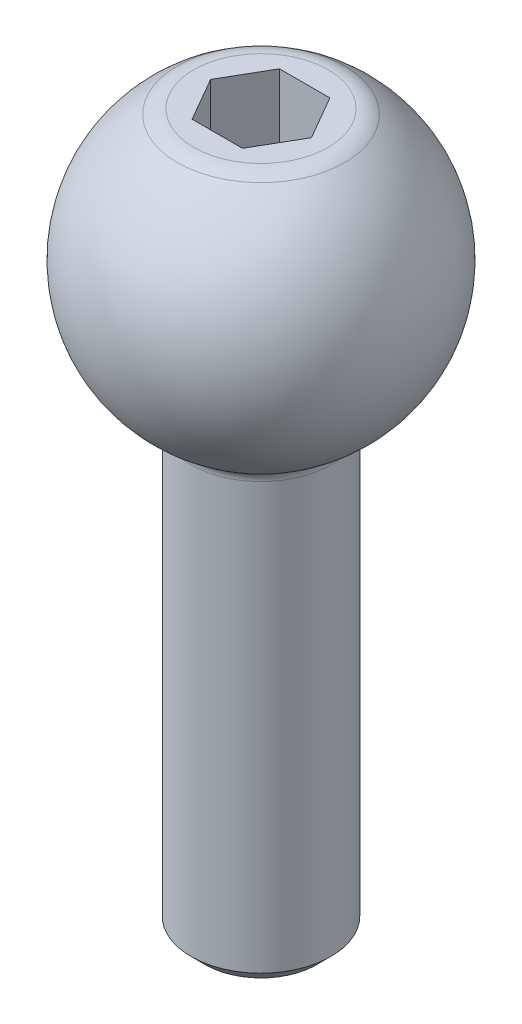
from build123d import *

# Parameters (mm, degrees)
FILLET1_R          = 0.381
CHAMFER1_SIZE      = 0.381
FILLET2_R          = 0.8128
CUT_EXTRUDE1_DEPTH = 2.54


with BuildPart() as part:
    # Sketch1 → Revolve1 (revolve)
    with BuildSketch(Plane.XY):
        with BuildLine():
            ThreePointArc((-1.905, -3.661588624), (-0.980573609, -4.009330573), (0, -4.1275))
            Line((0, -4.1275), (0, 4.1275))
            ThreePointArc((0, 4.1275), (-4.009330573, 0.980573609), (-1.905, -3.661588624))
        make_face()
        with BuildLine():
            Line((-1.905, -15.875), (0, -15.875))
            Line((0, -15.875), (0, -4.1275))
            ThreePointArc((0, -4.1275), (-0.980573609, -4.009330573), (-1.905, -3.661588624))
            Line((-1.905, -3.661588624), (-1.905, -15.875))
        make_face()
    revolve(axis=Axis((0, -107.836660193, 0), (0, 1, 0)))

    # Fillet1
    fillet1_edges = [part.edges().sort_by_distance(p)[0] for p in [
        (1.905, -3.661588624, 0),
    ]]
    fillet(fillet1_edges, radius=FILLET1_R)

    # Chamfer1
    chamfer1_edges = [part.edges().sort_by_distance(p)[0] for p in [
        (1.905, -15.875, 0),
    ]]
    chamfer(chamfer1_edges, length=CHAMFER1_SIZE)

    # Split1
    split(bisect_by=Plane.ZX.offset(3.574519854), keep=Keep.BOTTOM)

    # Fillet2
    fillet2_edges = [part.edges().sort_by_distance(p)[0] for p in [
        (2.06375, 3.574519854, 0),
    ]]
    fillet(fillet2_edges, radius=FILLET2_R)

    # Sketch4 → Cut-Extrude1 (cut)
    with BuildSketch(Plane(origin=(0, 3.574519854, 0), x_dir=(1, 0, 0), z_dir=(0, 1, 0))):
        Polygon((0.687407664, -1.190625), (1.374815329, 0), (0.687407664, 1.190625), (-0.687407664, 1.190625), (-1.374815329, 0), (-0.687407664, -1.190625), align=None)
    extrude(amount=-CUT_EXTRUDE1_DEPTH, mode=Mode.SUBTRACT)


solid = part.part
